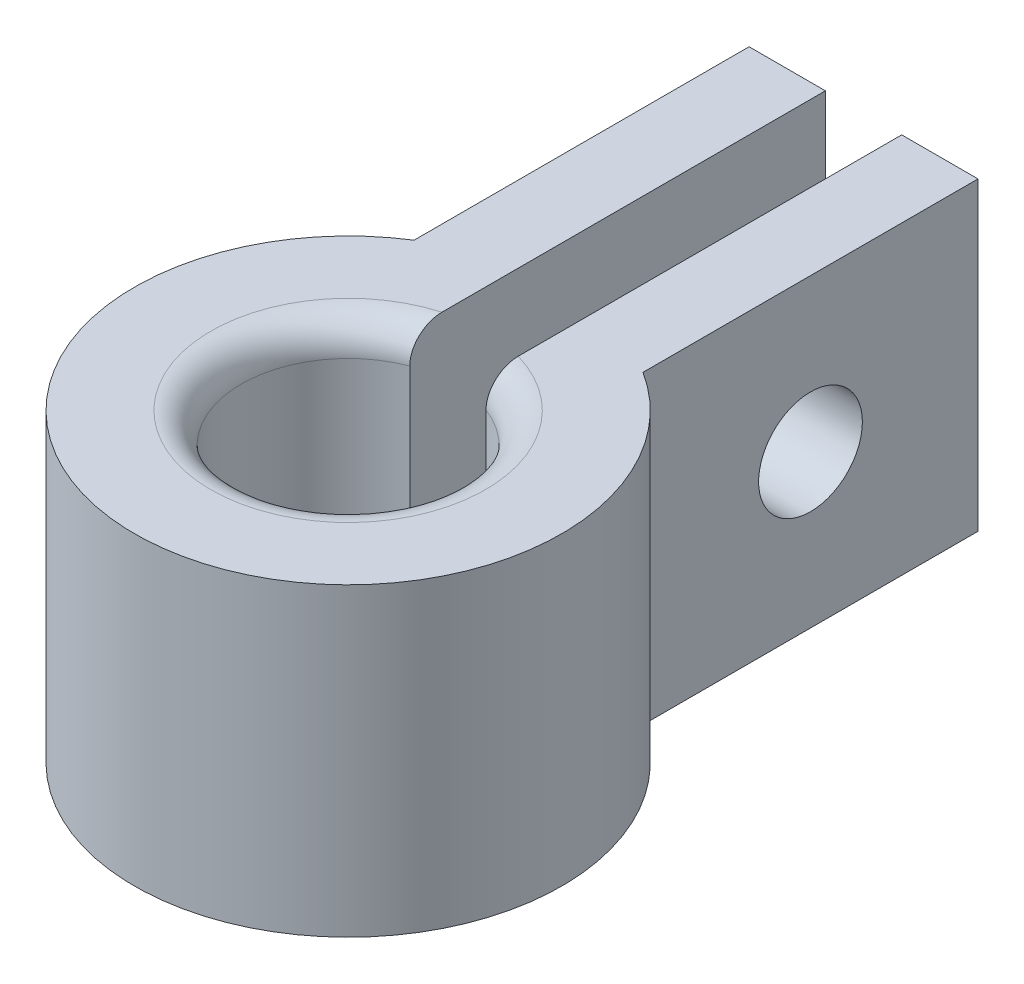
from build123d import *

# Parameters (mm, degrees)
BOSS_EXTRUDE1_DEPTH = 10
CUT_EXTRUDE1_REACH  = 24.377
SKETCH2_R           = 1.7
FILLET1_R           = 1


with BuildPart() as part:
    # Sketch1 → Boss-Extrude1 (new body)
    with BuildSketch(Plane(origin=(0, 0, 0), x_dir=(1, 0, 0), z_dir=(0, 1, 0))):
        with BuildLine():
            Line((13.75, 3.269174208), (13.75, 16.887488657))
            Line((13.75, 16.887488657), (11.25, 16.887488657))
            Line((11.25, 16.887488657), (11.25, 5.910795209))
            ThreePointArc((11.25, 5.910795209), (15, -7), (18.75, 5.910795209))
            Line((18.75, 5.910795209), (18.75, 16.887488657))
            Line((18.75, 16.887488657), (16.25, 16.887488657))
            Line((16.25, 16.887488657), (16.25, 3.269174208))
            ThreePointArc((16.25, 3.269174208), (15, -3.5), (13.75, 3.269174208))
        make_face()
    extrude(amount=BOSS_EXTRUDE1_DEPTH)

    # Cut-Extrude1: up to this face of the body (flat: up to its plane)
    cut_extrude1_end = Plane(part.part.faces().sort_by_distance((11.25, 5, -11.399141933))[0])
    # Sketch2 → Cut-Extrude1 (cut, up to the picked face)
    with BuildSketch(Plane(origin=(18.75, 0, 0), x_dir=(0, 0, -1), z_dir=(1, 0, 0)), mode=Mode.PRIVATE) as cut_extrude1_sk1:
        with Locations((11.399141933, 5)):
            Circle(SKETCH2_R)
    cut_extrude1_tool1 = split(extrude(cut_extrude1_sk1.sketch, amount=-CUT_EXTRUDE1_REACH, mode=Mode.PRIVATE), bisect_by=cut_extrude1_end, keep=Keep.BOTH, mode=Mode.PRIVATE)
    add(cut_extrude1_tool1.solids().sort_by(Axis((18.75, 5, -11.399142), (-1, 0, 0)))[0], mode=Mode.SUBTRACT)

    # Fillet1
    fillet1_edges = [part.edges().sort_by_distance(p)[0] for p in [
        (15, 10, 3.5),
    ]]
    fillet(fillet1_edges, radius=FILLET1_R)


solid = part.part
